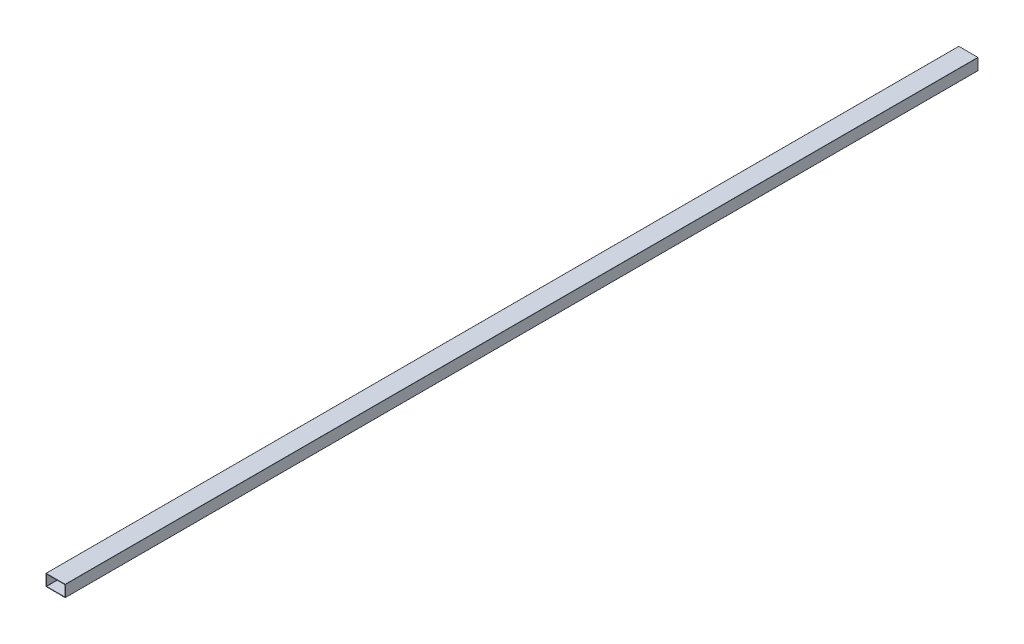
from build123d import *

# Parameters (mm, degrees)
CROQUIS1_W              = 127
CROQUIS1_H              = 76.2
CROQUIS1_W_2            = 120.92
CROQUIS1_H_2            = 70.12
SALIENTE_EXTRUIR1_DEPTH = 6000
REDONDEO1_R             = 1


with BuildPart() as part:
    # Croquis1 → Saliente-Extruir1 (new body)
    with BuildSketch(Plane.XY):
        Rectangle(CROQUIS1_W, CROQUIS1_H)
        Rectangle(CROQUIS1_W_2, CROQUIS1_H_2, mode=Mode.SUBTRACT)
    extrude(amount=-SALIENTE_EXTRUIR1_DEPTH)

    # Redondeo1
    redondeo1_edges = [part.edges().sort_by_distance(p)[0] for p in [
        (60.46, -35.06, -3000),
        (-60.46, -35.06, -3000),
        (-60.46, 35.06, -3000),
        (60.46, 35.06, -3000),
        (63.5, -38.1, -3000),
        (-63.5, -38.1, -3000),
        (-63.5, 38.1, -3000),
        (63.5, 38.1, -3000),
    ]]
    fillet(redondeo1_edges, radius=REDONDEO1_R)


solid = part.part
